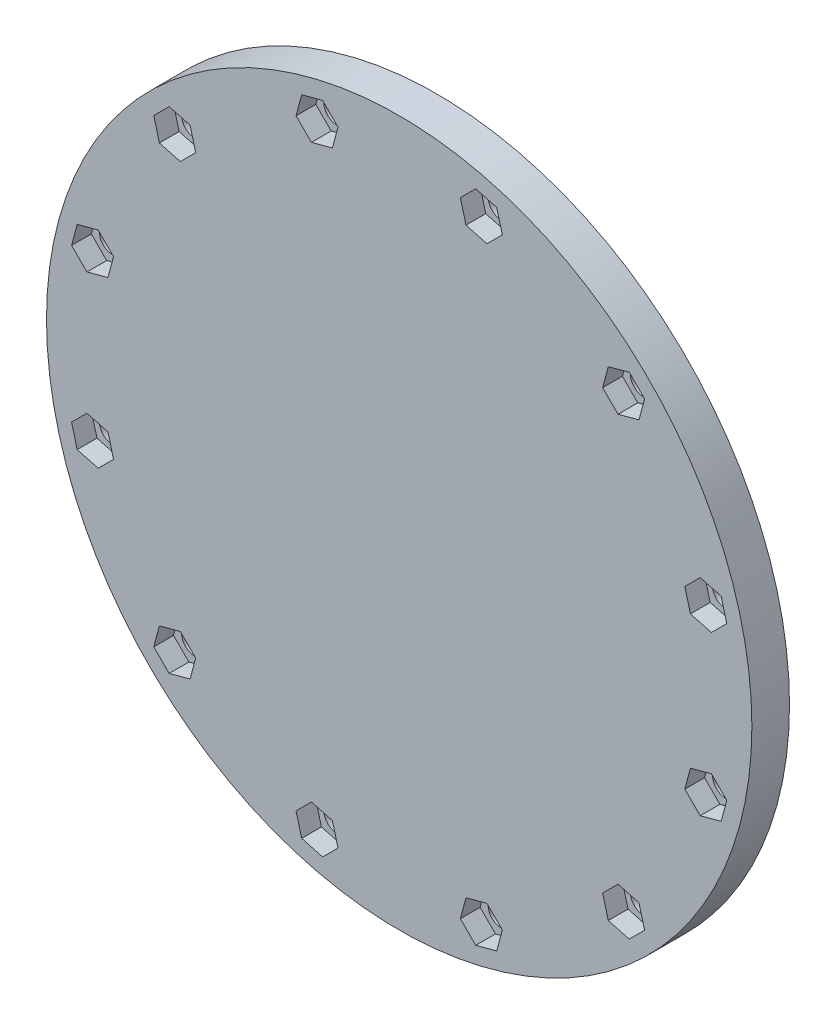
from build123d import *

# Parameters (mm, degrees)
SKETCH1_R            = 75
BOSS_EXTRUDE1_DEPTH  = 8
M5_CLEARANCE_HOLE1_D = 5.5
CUT_EXTRUDE2_DEPTH   = 4.2
SKETCH11_R           = 45.85
CUT_EXTRUDE3_DEPTH   = 6
SKETCH12_R           = 60.7695
SKETCH12_R_2         = 53.6575
CUT_EXTRUDE4_DEPTH   = 4.1656


with BuildPart() as part:
    # Sketch1 → Boss-Extrude1 (new body)
    with BuildSketch(Plane.XY):
        Circle(SKETCH1_R)
    extrude(amount=BOSS_EXTRUDE1_DEPTH)

    # M5 Clearance Hole1 (through all)
    with Locations(Plane(origin=(0, 0, 0), x_dir=(-1, 0, 0), z_dir=(0, 0, -1))):
        with Locations((-17.470285544, -65.199993275), (-47.72970773, 47.72970773), (65.199993275, -17.470285544), (47.72970773, -47.72970773), (-65.199993275, 17.470285544), (-17.470285544, 65.199993275), (-65.199993275, -17.470285544), (-47.72970773, -47.72970773), (17.470285544, -65.199993275), (65.199993275, 17.470285544), (47.72970773, 47.72970773), (17.470285544, 65.199993275)):
            Hole(M5_CLEARANCE_HOLE1_D / 2)

    # Sketch6 → Cut-Extrude2 (cut)
    with BuildSketch(Plane(origin=(0, 0, 8), x_dir=(-1, 0, 0), z_dir=(0, 0, -1))):
        Polygon((-43.268287443, 46.534273767), (-44.463721406, 50.995694054), (-48.925141693, 52.191128017), (-52.191128017, 48.925141693), (-50.995694054, 44.463721406), (-46.534273767, 43.268287443), align=None)
        Polygon((-13.008865258, 66.395427237), (-16.274851582, 69.661413561), (-20.736271868, 68.465979598), (-21.931705831, 64.004559312), (-18.665719507, 60.738572988), (-14.204299221, 61.934006951), align=None)
        Polygon((21.931705831, 64.004559312), (20.736271868, 68.465979598), (16.274851582, 69.661413561), (13.008865258, 66.395427237), (14.204299221, 61.934006951), (18.665719507, 60.738572988), align=None)
        Polygon((50.995694054, 44.463721406), (52.191128017, 48.925141693), (48.925141693, 52.191128017), (44.463721406, 50.995694054), (43.268287443, 46.534273767), (46.534273767, 43.268287444), align=None)
        Polygon((66.395427237, 13.008865258), (69.661413561, 16.274851582), (68.465979598, 20.736271868), (64.004559312, 21.931705831), (60.738572988, 18.665719507), (61.934006951, 14.204299221), align=None)
        Polygon((64.004559312, -21.931705831), (68.465979598, -20.736271868), (69.661413561, -16.274851582), (66.395427237, -13.008865258), (61.934006951, -14.204299221), (60.738572988, -18.665719507), align=None)
        Polygon((44.463721406, -50.995694054), (48.925141693, -52.191128017), (52.191128017, -48.925141693), (50.995694054, -44.463721406), (46.534273767, -43.268287443), (43.268287444, -46.534273767), align=None)
        Polygon((13.008865258, -66.395427237), (16.274851582, -69.661413561), (20.736271868, -68.465979598), (21.931705831, -64.004559312), (18.665719507, -60.738572988), (14.204299221, -61.934006951), align=None)
        Polygon((-21.931705831, -64.004559312), (-20.736271868, -68.465979598), (-16.274851582, -69.661413561), (-13.008865258, -66.395427237), (-14.204299221, -61.934006951), (-18.665719507, -60.738572988), align=None)
        Polygon((-50.995694054, -44.463721406), (-52.191128017, -48.925141693), (-48.925141693, -52.191128017), (-44.463721406, -50.995694054), (-43.268287443, -46.534273767), (-46.534273767, -43.268287443), align=None)
        Polygon((-66.395427237, -13.008865258), (-69.661413561, -16.274851582), (-68.465979598, -20.736271868), (-64.004559312, -21.931705831), (-60.738572988, -18.665719507), (-61.934006951, -14.204299221), align=None)
        Polygon((-64.004559312, 21.931705831), (-68.465979598, 20.736271868), (-69.661413561, 16.274851582), (-66.395427237, 13.008865258), (-61.934006951, 14.204299221), (-60.738572988, 18.665719507), align=None)
    extrude(amount=CUT_EXTRUDE2_DEPTH, mode=Mode.SUBTRACT)

    # Sketch11 → Cut-Extrude3 (cut)
    with BuildSketch(Plane(origin=(0, 0, 0), x_dir=(-1, 0, 0), z_dir=(0, 0, -1))):
        Circle(SKETCH11_R)
    extrude(amount=-CUT_EXTRUDE3_DEPTH, mode=Mode.SUBTRACT)

    # Sketch12 → Cut-Extrude4 (cut)
    with BuildSketch(Plane(origin=(0, 0, 0), x_dir=(-1, 0, 0), z_dir=(0, 0, -1))):
        Circle(SKETCH12_R)
        Circle(SKETCH12_R_2, mode=Mode.SUBTRACT)
    extrude(amount=-CUT_EXTRUDE4_DEPTH, mode=Mode.SUBTRACT)


solid = part.part
